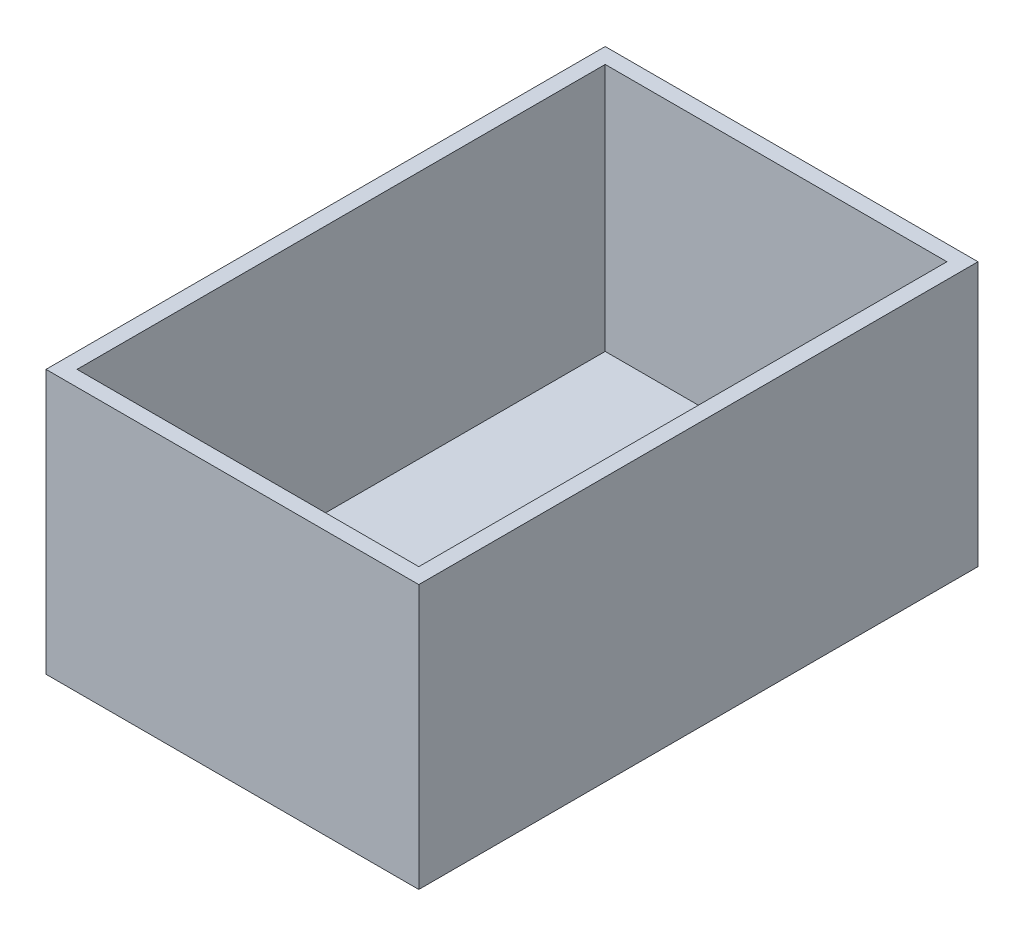
from build123d import *

# Parameters (mm, degrees)
SKETCH1_W           = 120
SKETCH1_H           = 180
BOSS_EXTRUDE1_DEPTH = 5
SKETCH2_W           = 120
SKETCH2_H           = 180
SKETCH2_W_2         = 110
SKETCH2_H_2         = 170
BOSS_EXTRUDE2_DEPTH = 80


with BuildPart() as part:
    # Sketch1 → Boss-Extrude1 (new body)
    with BuildSketch(Plane(origin=(0, 0, 0), x_dir=(1, 0, 0), z_dir=(0, 1, 0))):
        Rectangle(SKETCH1_W, SKETCH1_H)
    extrude(amount=BOSS_EXTRUDE1_DEPTH)

    # Sketch2 → Boss-Extrude2 (add)
    with BuildSketch(Plane(origin=(0, 5, 0), x_dir=(1, 0, 0), z_dir=(0, 1, 0))):
        Rectangle(SKETCH2_W, SKETCH2_H)
        Rectangle(SKETCH2_W_2, SKETCH2_H_2, mode=Mode.SUBTRACT)
    extrude(amount=BOSS_EXTRUDE2_DEPTH)


solid = part.part
